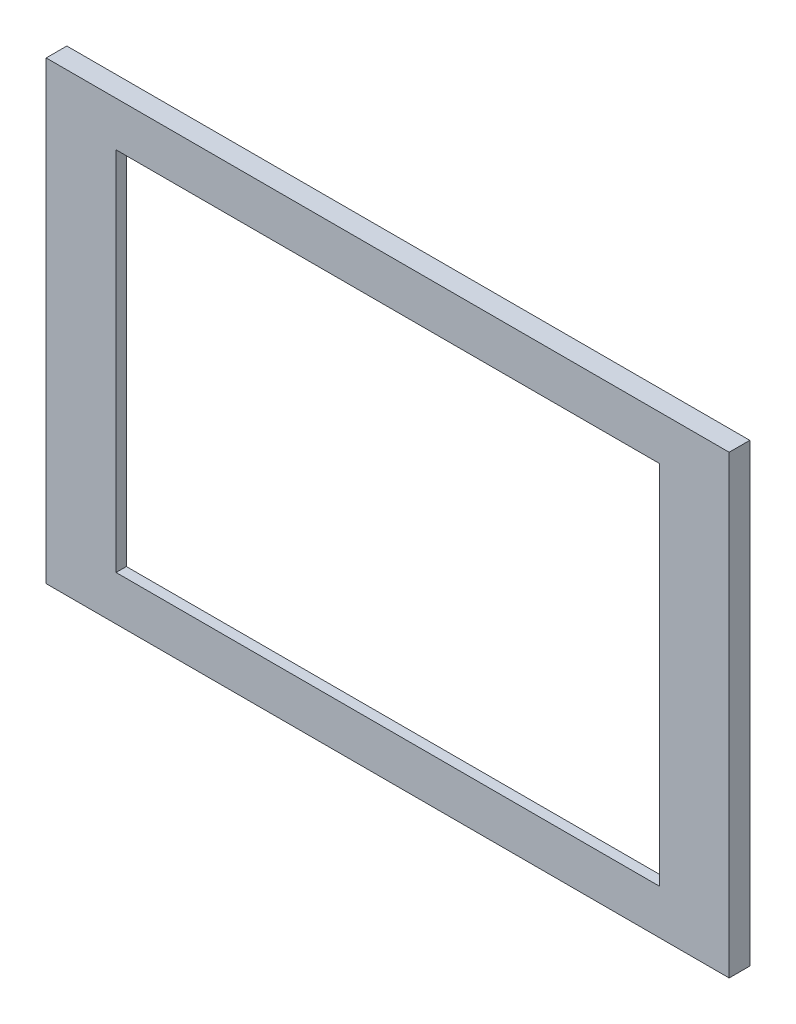
from build123d import *

# Parameters (mm, degrees)
SKETCH1_W           = 113.52
SKETCH1_H           = 111.28
SKETCH1_R           = 8.5
SKETCH1_W_2         = 6
SKETCH1_H_2         = 5.8
SKETCH1_W_3         = 83.52
SKETCH1_H_3         = 56.28
BOSS_EXTRUDE1_DEPTH = 3.175
SKETCH3_W           = 96.145
SKETCH3_H           = 61.08
SKETCH3_W_2         = 83.52
SKETCH3_H_2         = 56.28
CUT_EXTRUDE1_DEPTH  = 1.5875
SKETCH4_W           = 113.52
SKETCH4_H           = 111.28
SKETCH4_W_2         = 105
SKETCH4_H_2         = 70
CUT_EXTRUDE2_DEPTH  = 10


with BuildPart() as part:
    # Sketch1 → Boss-Extrude1 (new body)
    with BuildSketch(Plane.XY):
        with Locations((0, -12.5)):
            Rectangle(SKETCH1_W, SKETCH1_H)
        with Locations((-41.76, -53.14)):
            Circle(SKETCH1_R, mode=Mode.SUBTRACT)
        with Locations((41.76, -53.14)):
            Circle(SKETCH1_R, mode=Mode.SUBTRACT)
        with Locations((-7.5, -53.14)):
            Rectangle(SKETCH1_W_2, SKETCH1_H_2, mode=Mode.SUBTRACT)
        Rectangle(SKETCH1_W_3, SKETCH1_H_3, mode=Mode.SUBTRACT)
        with Locations((-22.5, -53.14)):
            Rectangle(SKETCH1_W_2, SKETCH1_H_2, mode=Mode.SUBTRACT)
        with Locations((7.5, -53.14)):
            Rectangle(SKETCH1_W_2, SKETCH1_H_2, mode=Mode.SUBTRACT)
        with Locations((22.5, -53.14)):
            Rectangle(SKETCH1_W_2, SKETCH1_H_2, mode=Mode.SUBTRACT)
    extrude(amount=BOSS_EXTRUDE1_DEPTH)

    # Sketch3 → Cut-Extrude1 (cut)
    with BuildSketch(Plane(origin=(0, 0, 0), x_dir=(-1, 0, 0), z_dir=(0, 0, -1))):
        with Locations((0.6875, 0)):
            Rectangle(SKETCH3_W, SKETCH3_H)
        Rectangle(SKETCH3_W_2, SKETCH3_H_2, mode=Mode.SUBTRACT)
    extrude(amount=-CUT_EXTRUDE1_DEPTH, mode=Mode.SUBTRACT)

    # Sketch4 → Cut-Extrude2 (cut)
    with BuildSketch(Plane.XY.offset(3.175)):
        with Locations((0, -12.5)):
            Rectangle(SKETCH4_W, SKETCH4_H)
        Rectangle(SKETCH4_W_2, SKETCH4_H_2, mode=Mode.SUBTRACT)
    extrude(amount=-CUT_EXTRUDE2_DEPTH, mode=Mode.SUBTRACT)


solid = part.part
